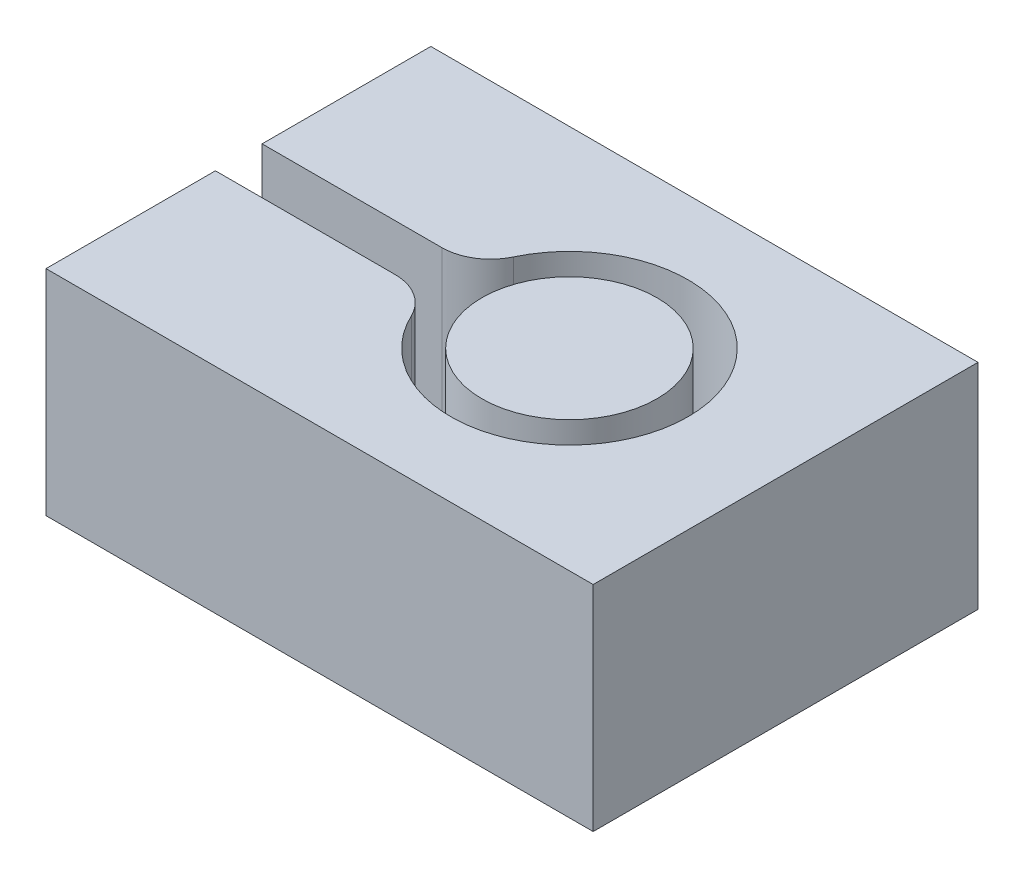
from build123d import *
from build123d.topology import SkipClean

# Parameters (mm, degrees)
BOSS_EXTRUDE3_DEPTH   = 8
SKETCH2_R             = 4.5
BOSS_EXTRUDE3_2_DEPTH = 8
SKETCH4_W             = 25.128147065
SKETCH4_H             = 19.783027293
BOSS_EXTRUDE4_DEPTH   = 3
SKETCH5_W             = 19.783027293
SKETCH5_H             = 11
BOSS_EXTRUDE5_DEPTH   = 3
BOSS_EXTRUDE6_START   = -8
BOSS_EXTRUDE6_DEPTH   = 8


with BuildPart() as part:
    # Sketch2 → Boss-Extrude3 (new body)
    with BuildSketch(Plane(origin=(0, 0, 0), x_dir=(1, 0, 0), z_dir=(0, 1, 0))):
        with BuildLine():
            Line((0, 19.783027293), (0, 11.408726598))
            Line((0, 11.408726598), (9.090512027, 11.408726598))
            ThreePointArc((9.090512027, 11.408726598), (10.598731266, 11.815413134), (11.698035534, 12.925210115))
            ThreePointArc((11.698035534, 12.925210115), (23.1, 9.908726598), (11.698035534, 6.892243082))
            ThreePointArc((11.698035534, 6.892243082), (10.598731266, 8.002040063), (9.090512027, 8.408726598))
            Line((9.090512027, 8.408726598), (0, 8.408726598))
            Line((0, 8.408726598), (0, 0))
            Line((0, 0), (25.128147065, 0))
            Line((25.128147065, 0), (25.128147065, 19.783027293))
            Line((25.128147065, 19.783027293), (0, 19.783027293))
        make_face()
    extrude(amount=BOSS_EXTRUDE3_DEPTH)



with BuildPart() as body_2:
    # Sketch2 → Boss-Extrude3 2 (new body)
    with BuildSketch(Plane(origin=(0, 0, 0), x_dir=(1, 0, 0), z_dir=(0, 1, 0))):
        with Locations(Location((17, 9.908726598, 0), (0, 0, 270))):
            Circle(SKETCH2_R)
    extrude(amount=BOSS_EXTRUDE3_2_DEPTH)


with BuildPart() as part_1:
    add(part.part)

    add(body_2.part)  # Boss-Extrude4 merges body 2
    # Sketch4 → Boss-Extrude4 (add)
    with BuildSketch(Plane.XZ):
        with Locations((12.564073533, -9.891513646)):
            Rectangle(SKETCH4_W, SKETCH4_H)
    extrude(amount=BOSS_EXTRUDE4_DEPTH)

    # Sketch5 → Boss-Extrude5 (add)
    with BuildSketch(Plane(origin=(25.128147065, 0, 0), x_dir=(0, 0, -1), z_dir=(1, 0, 0))):
        with Locations((9.891513646, 2.5)):
            Rectangle(SKETCH5_W, SKETCH5_H)
    extrude(amount=BOSS_EXTRUDE5_DEPTH)

    # Sketch6 → Boss-Extrude6 (add)
    with SkipClean():  # the faces are left unmerged after this step: merging them gives an invalid solid
        with BuildSketch(Plane(origin=(0, 8, 0), x_dir=(1, 0, 0), z_dir=(0, 1, 0)).offset(BOSS_EXTRUDE6_START)):
            with BuildLine():
                ThreePointArc((11.493419665, 12.533145203), (10.570986936, 11.494612896), (9.236624446, 11.108726598))
                Line((9.236624446, 11.108726598), (0, 11.108726598))
                Line((0, 11.108726598), (0, 11.408726598))
                Line((0, 11.408726598), (9.090512027, 11.408726598))
                ThreePointArc((9.090512027, 11.408726598), (10.598731266, 11.815413134), (11.698035534, 12.925210115))
                ThreePointArc((11.698035534, 12.925210115), (11.592173366, 12.731032588), (11.493419665, 12.533145203))
            make_face()
            with BuildLine():
                ThreePointArc((11.493419665, 7.284307994), (11.592173366, 7.086420609), (11.698035534, 6.892243082))
                ThreePointArc((11.698035534, 6.892243082), (10.598731266, 8.002040063), (9.090512027, 8.408726598))
                Line((9.090512027, 8.408726598), (0, 8.408726598))
                Line((0, 8.408726598), (0, 8.708726598))
                Line((0, 8.708726598), (9.236624446, 8.708726598))
                ThreePointArc((9.236624446, 8.708726598), (10.570986936, 8.3228403), (11.493419665, 7.284307994))
            make_face()
        extrude(amount=BOSS_EXTRUDE6_DEPTH)


solid = part_1.part
